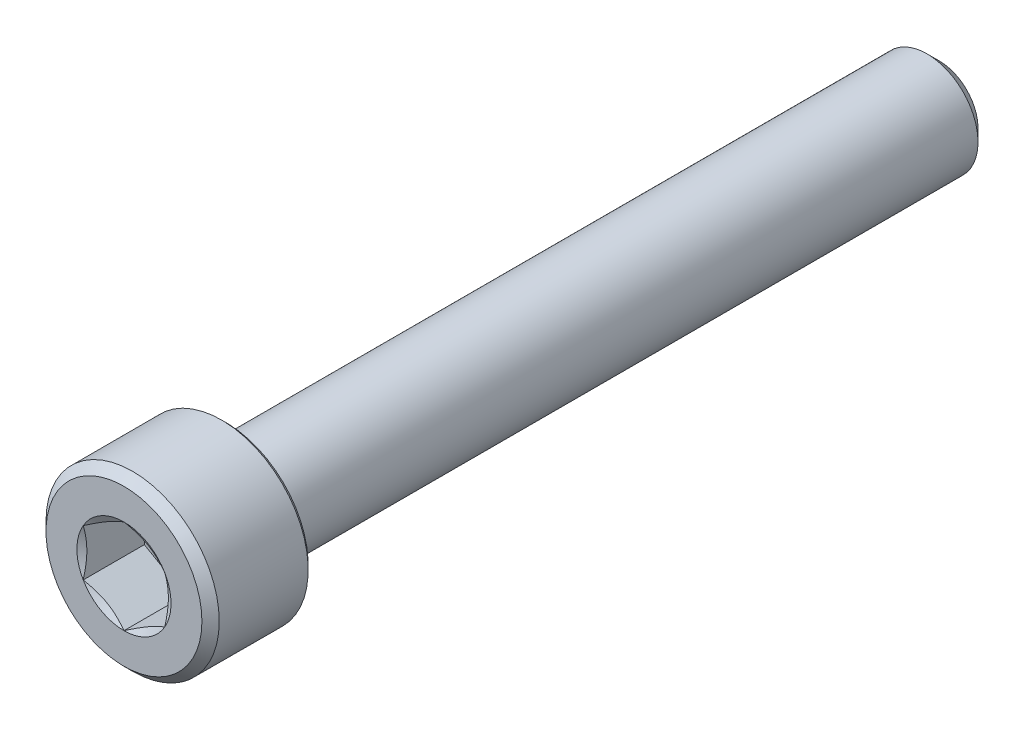
from build123d import *

# Parameters (mm, degrees)
CUT_EXTRUDE1_DEPTH = 3
CHAMFER1_SIZE      = 0.425
CHAMFER2_SIZE      = 0.2125


with BuildPart() as part:
    # Sketch2 → Revolve1 (revolve)
    with BuildSketch(Plane(origin=(0, 0, 0), x_dir=(0, 0, -1), z_dir=(1, 0, 0))):
        Polygon((20, 1.9), (19.4, 2.5), (-15, 2.5), (-15, 4.25), (-20, 4.25), (-20, 0), (20, 0), align=None)
    revolve(axis=Axis((0, 0, -20), (0, 0, 1)))

    # Sketch4 → Cut-Extrude1 (cut)
    with BuildSketch(Plane.XY.offset(20)):
        Polygon((0, 2.309401077), (-2, 1.154700538), (-2, -1.154700538), (0, -2.309401077), (2, -1.154700538), (2, 1.154700538), align=None)
    extrude(amount=-CUT_EXTRUDE1_DEPTH, mode=Mode.SUBTRACT)

    # Cut-Extrude2 cone 1 section (through the dimple's axis) → Cut-Extrude2 (revolve, cut)
    with BuildSketch(Plane(origin=(0, 0, 20), x_dir=(0, -1, 0), z_dir=(1, 0, 0))):
        Polygon((0, 0), (2.309401077, 0), (0, 1.333333333), align=None)
    revolve(axis=Axis((0, 0, 20), (0, 0, -1)), mode=Mode.SUBTRACT)

    # Chamfer1
    chamfer1_edges = [part.edges().sort_by_distance(p)[0] for p in [
        (0, -4.25, 20),
    ]]
    chamfer(chamfer1_edges, length=CHAMFER1_SIZE)

    # Chamfer2
    chamfer2_edges = [part.edges().sort_by_distance(p)[0] for p in [
        (0, -4.25, 15),
    ]]
    chamfer(chamfer2_edges, length=CHAMFER2_SIZE)


solid = part.part
